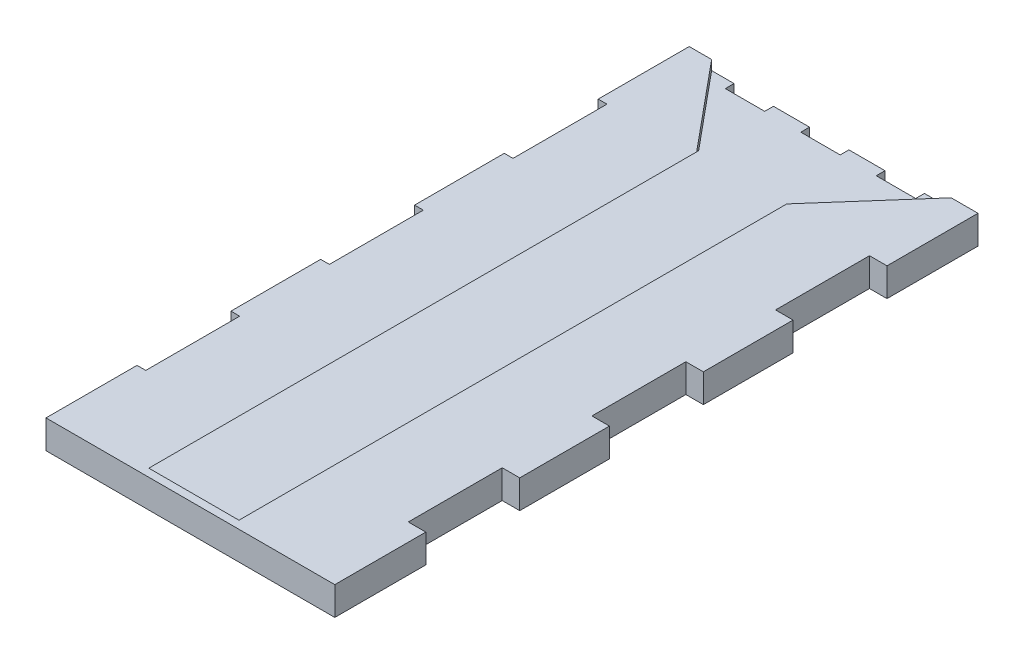
from build123d import *

# Parameters (mm, degrees)
SKETCH_4_W          = 60
SKETCH_4_H          = 145
EXTRUDE_1_DEPTH     = 6.5
SKETCH_5_W          = 8.25
SKETCH_5_H          = 6.5
EXTRUDE_2_DEPTH     = 2
SKETCH_7_W          = 20.8
SKETCH_7_H          = 6.5
SKETCH_7_W_2        = 20.5
EXTRUDE_3_DEPTH     = 4
EXTRUDE_START       = -60
SKETCH_7_2_W        = 20.8
SKETCH_7_2_H        = 6.5
SKETCH_7_2_W_2      = 20.5
EXTRUDE_4_DEPTH     = 2
CUT_EXTRUDE_START   = -1.8
CUT_EXTRUDE_1_DEPTH = 150.220693946
CUT_EXTRUDE_2_DEPTH = 83.004512071


with BuildPart() as part:
    # 草图4 → 凸台-拉伸1 (new body)
    with BuildSketch(Plane(origin=(0, 0, 0), x_dir=(1, 0, 0), z_dir=(0, 1, 0))):
        Rectangle(SKETCH_4_W, SKETCH_4_H)
    extrude(amount=EXTRUDE_1_DEPTH)

    # 草图5 → 凸台-拉伸2 (add)
    with BuildSketch(Plane(origin=(0, 0, -72.5), x_dir=(-1, 0, 0), z_dir=(0, 0, -1))):
        with Locations((-25.875, 3.25)):
            Rectangle(SKETCH_5_W, SKETCH_5_H)
        with Locations((-8.625, 3.25)):
            Rectangle(SKETCH_5_W, SKETCH_5_H)
        with Locations((8.625, 3.25)):
            Rectangle(SKETCH_5_W, SKETCH_5_H)
        with Locations((25.875, 3.25)):
            Rectangle(SKETCH_5_W, SKETCH_5_H)
    extrude(amount=EXTRUDE_2_DEPTH)

    # 草图7 → 凸台-拉伸3 (add)
    with BuildSketch(Plane(origin=(30, 0, 0), x_dir=(0, 0, -1), z_dir=(1, 0, 0))):
        with Locations((-62.1, 3.25)):
            Rectangle(SKETCH_7_W, SKETCH_7_H)
        with Locations((-19.983333333, 3.25)):
            Rectangle(SKETCH_7_W_2, SKETCH_7_H)
        with Locations((21.983333333, 3.25)):
            Rectangle(SKETCH_7_W_2, SKETCH_7_H)
        with Locations((64.1, 3.25)):
            Rectangle(SKETCH_7_W, SKETCH_7_H)
    extrude(amount=EXTRUDE_3_DEPTH)

    # 草图7<2> → 凸台-拉伸4 (add)
    with BuildSketch(Plane(origin=(30, 0, 0), x_dir=(0, 0, -1), z_dir=(1, 0, 0)).offset(EXTRUDE_START)):
        with Locations((-62.1, 3.25)):
            Rectangle(SKETCH_7_2_W, SKETCH_7_2_H)
        with Locations((-19.983333333, 3.25)):
            Rectangle(SKETCH_7_2_W_2, SKETCH_7_2_H)
        with Locations((21.983333333, 3.25)):
            Rectangle(SKETCH_7_2_W_2, SKETCH_7_2_H)
        with Locations((64.1, 3.25)):
            Rectangle(SKETCH_7_2_W, SKETCH_7_2_H)
    extrude(amount=-EXTRUDE_4_DEPTH)

    # 草图8 → 切除-拉伸1 (cut, through all)
    with BuildSketch(Plane.XY.offset(72.5).offset(CUT_EXTRUDE_START)):
        Polygon((10.3, 6.5), (-10.3, 6.5), (-12.5, 4.3), (-10.3, 4.3), (10.3, 4.3), (12.5, 4.3), align=None)
    extrude(amount=-CUT_EXTRUDE_1_DEPTH, mode=Mode.SUBTRACT)

    # 草图9 → 切除-拉伸2 (cut, through all)
    with BuildSketch(Plane(origin=(0, 4.3, 0), x_dir=(1, 0, 0), z_dir=(0, 1, 0))):
        Polygon((-26.875, 74.5), (-10.3, 54.5), (10.3, 54.5), (27.875, 74.5), align=None)
    extrude(amount=CUT_EXTRUDE_2_DEPTH, mode=Mode.SUBTRACT)


solid = part.part
